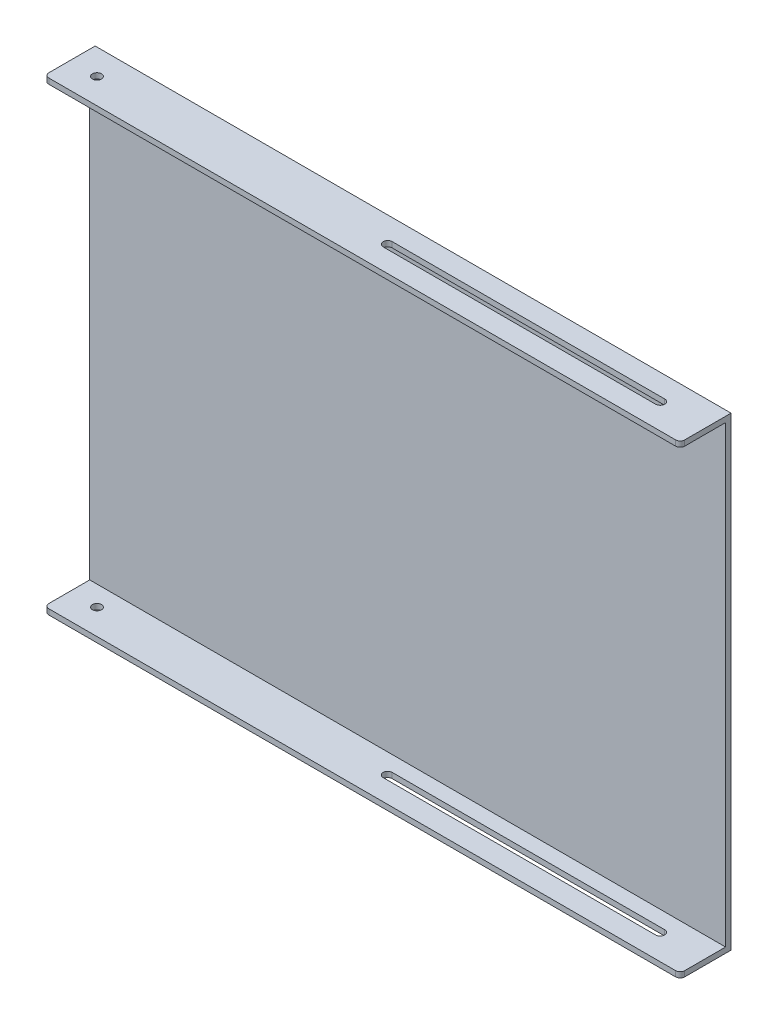
from build123d import *

# Parameters (mm, degrees)
SKETCH4_R               = 5
BOSS_EXTRUDE2_DEPTH     = 256
CUT_EXTRUDE2_DEPTH      = 746.868621139
CUT_EXTRUDE2_DEPTH_BACK = 746.868621139
SKETCH5_W               = 50
SKETCH5_H               = 500


with BuildPart() as part:
    # Sketch4 → Boss-Extrude2 (new, symmetric)
    with BuildSketch(Plane(origin=(0, 0, 0), x_dir=(1, 0, 0), z_dir=(0, 1, 0))):
        with BuildLine():
            Line((-350, 28), (350, 28))
            Line((350, 28), (350, -23))
            ThreePointArc((350, -23), (348.535533906, -26.535533906), (345, -28))
            Line((345, -28), (-345, -28))
            ThreePointArc((-345, -28), (-348.535533906, -26.535533906), (-350, -23))
            Line((-350, -23), (-350, 28))
        make_face()
        with Locations(Location((-320, 0, 0), (0, 0, 270))):
            Circle(SKETCH4_R, mode=Mode.SUBTRACT)
        with BuildLine():
            Line((0, 5), (300, 5))
            ThreePointArc((300, 5), (305, 0), (300, -5))
            Line((300, -5), (0, -5))
            ThreePointArc((0, -5), (-5, 0), (0, 5))
        make_face(mode=Mode.SUBTRACT)
    extrude(amount=BOSS_EXTRUDE2_DEPTH, both=True)

    # Sketch5 → Cut-Extrude2 (cut, two sides: drawn at the far end of the back side and taken through both)
    with BuildSketch(Plane(origin=(350, 0, 0), x_dir=(0, 0, -1), z_dir=(1, 0, 0)).offset(-CUT_EXTRUDE2_DEPTH_BACK)):
        with Locations((-3, 0)):
            Rectangle(SKETCH5_W, SKETCH5_H)
    extrude(amount=CUT_EXTRUDE2_DEPTH + CUT_EXTRUDE2_DEPTH_BACK, mode=Mode.SUBTRACT)


solid = part.part
